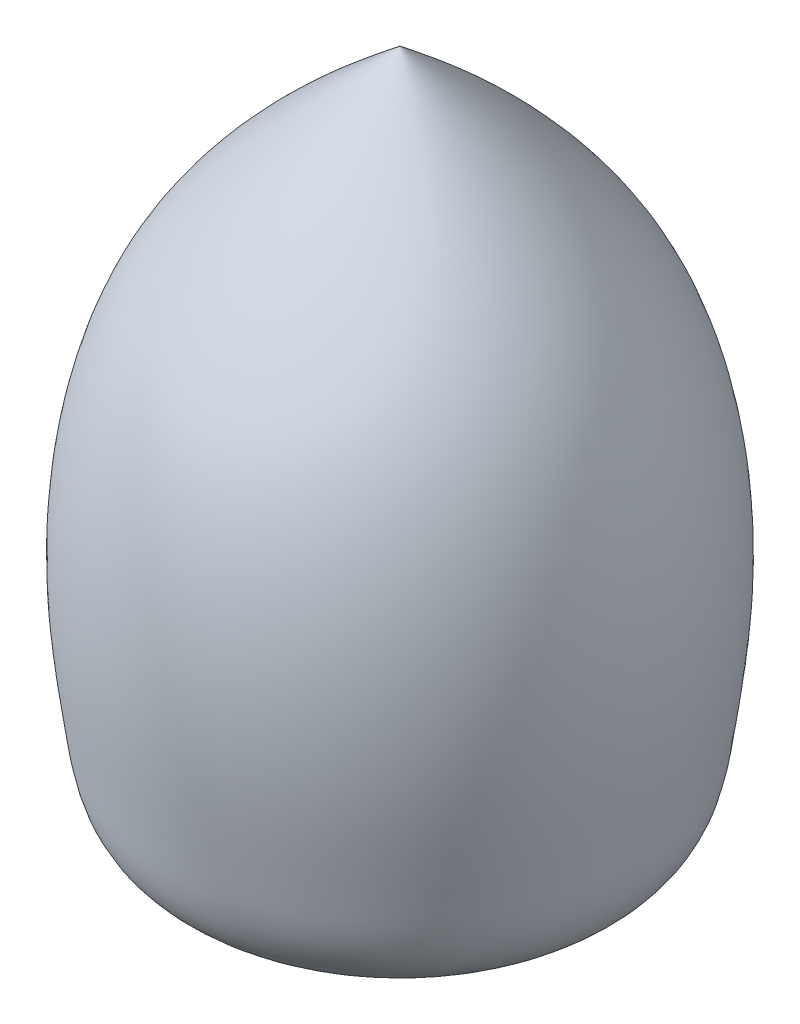
from build123d import *


with BuildPart() as part:
    # 草圖1 → 旋轉1 (revolve)
    with BuildSketch(Plane.XY):
        with BuildLine():
            Line((0, 0), (0, 5.5))
            add(Edge.make_bspline(
                [(1.0770319, 0), (1.206686902, 0.005790132), (1.454970461, 0.016877977), (1.833756203, 0.302263081), (1.919646684, 0.908035539), (2.083928352, 2.062976098), (1.837507142, 3.989342222), (0.625856647, 4.985468551), (0, 5.5)],
                knots=[0, 0, 0, 0, 0.057455761, 0.110025226, 0.197662421, 0.316902329, 0.647157972, 1, 1, 1, 1], degree=3))
            Line((1.0770319, 0), (0.850142369, 0))
            add(Edge.make_bspline(
                [(0.850142369, 0), (0.720754248, -0.021184794), (0.563104229, -0.046209171), (0.279544699, -0.047629042), (0.127362274, 0), (0, 0)],
                knots=[0, 0, 0, 0, 0.456469569, 0.556469569, 1, 1, 1, 1], degree=3))
        make_face()
    revolve(axis=Axis((0, 0, 0), (0, 1, 0)))


solid = part.part
